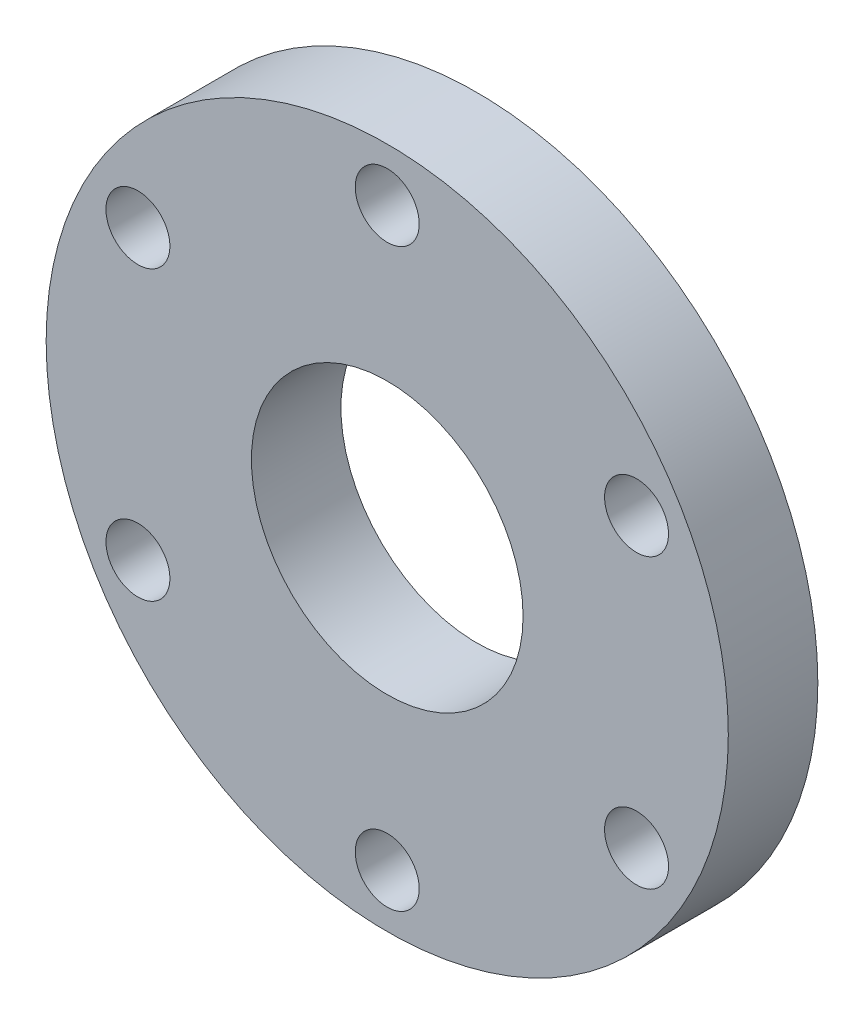
from build123d import *

# Parameters (mm, degrees)
SKETCH1_R           = 50.8
BOSS_EXTRUDE1_DEPTH = 6.6675
SKETCH2_R           = 20.2311
CUT_EXTRUDE1_DEPTH  = 74.06916056
SKETCH3_R           = 4.7625
CUT_EXTRUDE2_DEPTH  = 74.06916056
CIRPATTERN1_COUNT   = 6


with BuildPart() as part:
    # Sketch1 → Boss-Extrude1 (new, symmetric)
    with BuildSketch(Plane.XY):
        Circle(SKETCH1_R)
    extrude(amount=BOSS_EXTRUDE1_DEPTH, both=True)

    # Sketch2 → Cut-Extrude1 (cut, through all)
    with BuildSketch(Plane.XY.offset(6.6675)):
        Circle(SKETCH2_R)
    extrude(amount=-CUT_EXTRUDE1_DEPTH, mode=Mode.SUBTRACT)

    # Sketch3 → Cut-Extrude2 (cut, through all)
    with BuildSketch(Plane.XY.offset(6.6675)):
        with Locations((0, 42.8752)):
            Circle(SKETCH3_R)
    cut_extrude2 = extrude(amount=-CUT_EXTRUDE2_DEPTH, mode=Mode.SUBTRACT)

    # CirPattern1: Cut-Extrude2 ×6 about axis
    cirpattern1_axis = Axis((0, 0, -88.99), (0, 0, 1))
    for i in range(1, CIRPATTERN1_COUNT):
        add(cut_extrude2.rotate(cirpattern1_axis, i * 360 / CIRPATTERN1_COUNT), mode=Mode.SUBTRACT)


solid = part.part
